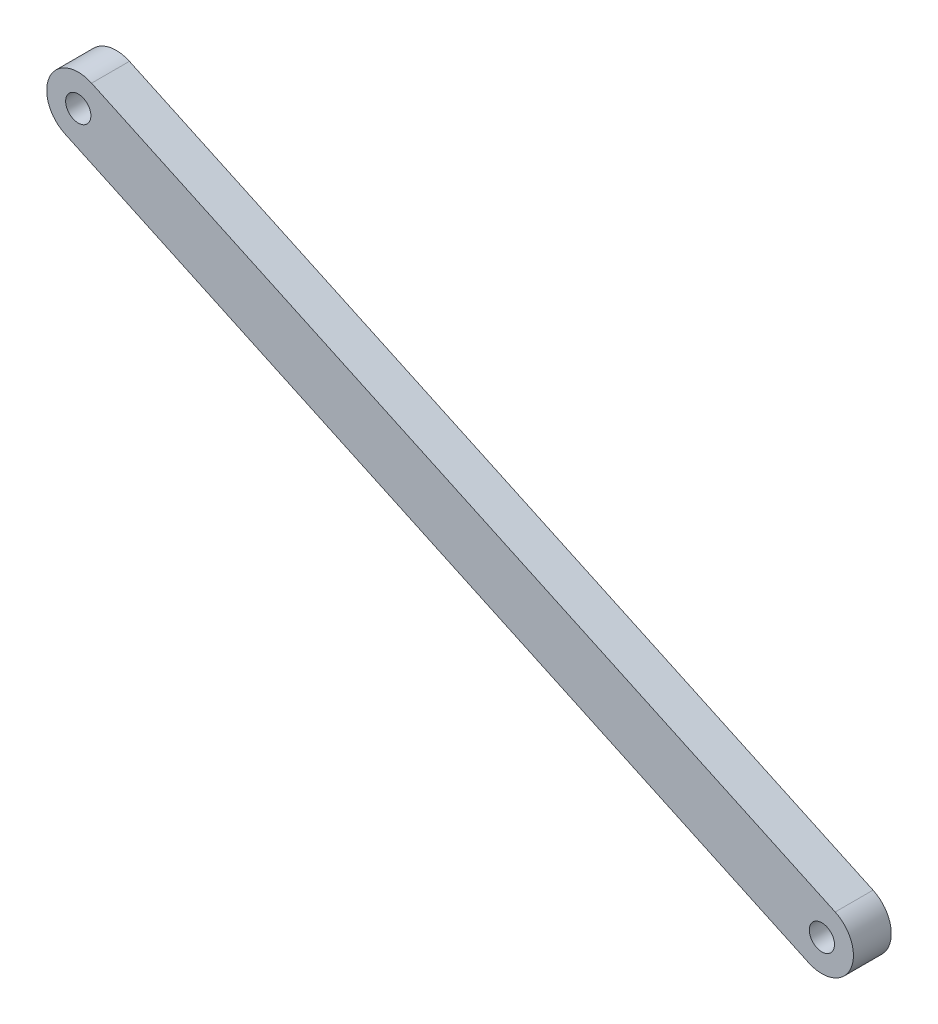
from build123d import *

# Parameters (mm, degrees)
SKETCH1_R           = 1
BOSS_EXTRUDE1_DEPTH = 3


with BuildPart() as part:
    # Sketch1 → Boss-Extrude1 (new body)
    with BuildSketch(Plane.XY):
        with BuildLine():
            Line((-19.600992406, 58.446570176), (39.333202361, 31.028315542))
            ThreePointArc((39.333202361, 31.028315542), (40.545353904, 27.707067488), (37.22410585, 26.494915944))
            Line((37.22410585, 26.494915944), (-21.710088916, 53.913170579))
            ThreePointArc((-21.710088916, 53.913170579), (-22.92224046, 57.234418633), (-19.600992406, 58.446570176))
        make_face()
        with Locations((-20.655540661, 56.179870378)):
            Circle(SKETCH1_R, mode=Mode.SUBTRACT)
        with Locations((38.278654105, 28.761615743)):
            Circle(SKETCH1_R, mode=Mode.SUBTRACT)
    extrude(amount=BOSS_EXTRUDE1_DEPTH)


solid = part.part
